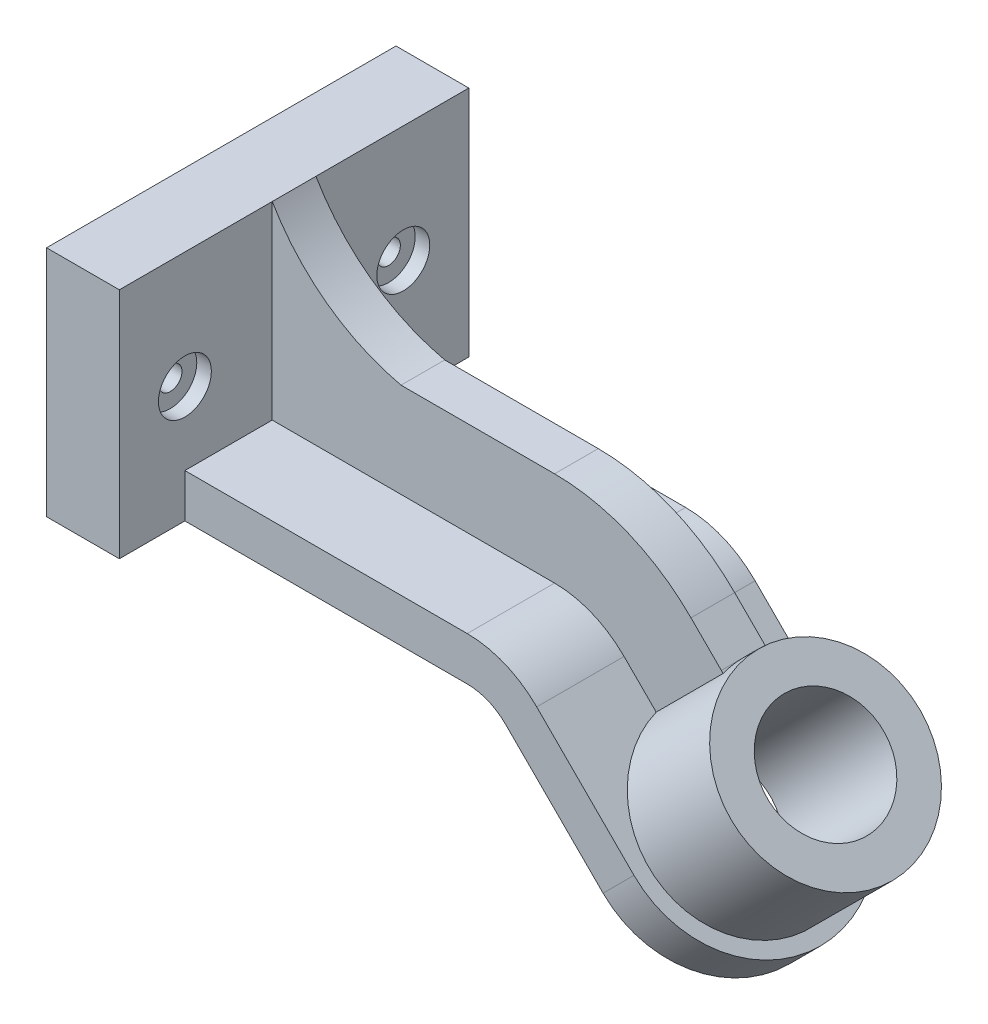
from build123d import *

# Parameters (mm, degrees)
SKETCH1_W                               = 96
SKETCH1_H                               = 64
BOSS_EXTRUDE1_DEPTH                     = 20
CBORE_FOR_M6_HEX_HEAD_BOLT1_D           = 6.4
CBORE_FOR_M6_HEX_HEAD_BOLT1_CBORE_D     = 14.547
CBORE_FOR_M6_HEX_HEAD_BOLT1_CBORE_DEPTH = 4
BOSS_EXTRUDE3_DEPTH                     = 60
CUT_EXTRUDE1_DEPTH                      = 12
SKETCH14_R                              = 26
SKETCH14_R_2                            = 16
BOSS_EXTRUDE4_DEPTH                     = 32
BOSS_EXTRUDE8_START                     = -12
BOSS_EXTRUDE8_DEPTH                     = 12
SKETCH17_R                              = 16
CUT_EXTRUDE2_DEPTH                      = 198.440406876


with BuildPart() as part:
    # Sketch1 → Boss-Extrude1 (new body)
    with BuildSketch(Plane(origin=(0, 0, 0), x_dir=(0, 0, -1), z_dir=(1, 0, 0))):
        Rectangle(SKETCH1_W, SKETCH1_H)
    extrude(amount=BOSS_EXTRUDE1_DEPTH)

    # CBORE for M6 Hex Head Bolt1 (through all)
    with Locations(Plane(origin=(20, 0, -30), x_dir=(0, 0, 1), z_dir=(1, 0, 0))):
        with Locations((0, 0)):
            cbore_for_m6_hex_head_bolt1 = CounterBoreHole(CBORE_FOR_M6_HEX_HEAD_BOLT1_D / 2, CBORE_FOR_M6_HEX_HEAD_BOLT1_CBORE_D / 2, CBORE_FOR_M6_HEX_HEAD_BOLT1_CBORE_DEPTH)

    # Mirror1: CBORE for M6 Hex Head Bolt1 across plane
    add(cbore_for_m6_hex_head_bolt1.mirror(Plane.XY), mode=Mode.SUBTRACT)

    # Sketch11 → Boss-Extrude3 (add)
    with BuildSketch(Plane(origin=(0, 0, -30), x_dir=(0, -1, 0), z_dir=(0, 0, 1))):
        with BuildLine():
            ThreePointArc((20, 97.56139982), (22.055252622, 107.893852494), (27.908116908, 116.653282912))
            Line((27.908116908, 116.653282912), (75.840620434, 164.585786438))
            Line((75.840620434, 164.585786438), (84.325901808, 156.100505063))
            Line((84.325901808, 156.100505063), (36.393398282, 108.168001538))
            ThreePointArc((36.393398282, 108.168001538), (33.141807012, 103.301651305), (32, 97.56139982))
            Line((32, 97.56139982), (32, 20))
            Line((32, 20), (20, 20))
            Line((20, 20), (20, 97.56139982))
        make_face()
    extrude(amount=BOSS_EXTRUDE3_DEPTH)

    # Sketch13 → Cut-Extrude1 (cut)
    with BuildSketch(Plane(origin=(44.372583002, 44.372583002, 0), x_dir=(0, 0, -1), z_dir=(0.7071067811865476, 0.7071067811865476, 0))):
        with BuildLine():
            Line((-30, -140.007142675), (-38.734920635, -140.007142675))
            Line((-38.734920635, -140.007142675), (-38.734920635, -179.207032884))
            Line((-38.734920635, -179.207032884), (30.889896781, -179.207032884))
            Line((30.889896781, -179.207032884), (30.889896781, -140.007142675))
            Line((30.889896781, -140.007142675), (30, -140.007142675))
            ThreePointArc((30, -140.007142675), (0, -170.007142675), (-30, -140.007142675))
        make_face()
    extrude(amount=-CUT_EXTRUDE1_DEPTH, mode=Mode.SUBTRACT)

    # Sketch14 → Boss-Extrude4 (add)
    with BuildSketch(Plane(origin=(44.372583002, 44.372583002, 0), x_dir=(0, 0, -1), z_dir=(0.7071067811865476, 0.7071067811865476, 0))):
        with Locations(Location((0, -140.007142675, 0), (0, 0, 90))):
            Circle(SKETCH14_R)
        with Locations(Location((0, -140.007142675, 0), (0, 0, 90))):
            Circle(SKETCH14_R_2, mode=Mode.SUBTRACT)
    extrude(amount=BOSS_EXTRUDE4_DEPTH)

    # Sketch16 → Boss-Extrude8 (add)
    with BuildSketch(Plane.XY.offset(6).offset(BOSS_EXTRUDE8_START)):
        with BuildLine():
            Line((20, 32), (20, -20))
            Line((20, -20), (97.56139982, -20))
            ThreePointArc((97.56139982, -20), (107.893852494, -22.055252622), (116.653282912, -27.908116908))
            Line((116.653282912, -27.908116908), (124.987806691, -36.242640687))
            Line((124.987806691, -36.242640687), (132.712452622, -43.967286618))
            Line((132.712452622, -43.967286618), (151.159621824, -25.520117415))
            Line((151.159621824, -25.520117415), (143.372583002, -17.857864376))
            Line((143.372583002, -17.857864376), (135.038059223, -9.523340597))
            ThreePointArc((135.038059223, -9.523340597), (117.843621735, 1.965615223), (97.56139982, 6))
            Line((97.56139982, 6), (55.38418899, 6))
            ThreePointArc((55.38418899, 6), (34.984926343, 15.315732711), (20, 32))
        make_face()
    extrude(amount=BOSS_EXTRUDE8_DEPTH)

    # Sketch17 → Cut-Extrude2 (cut, through all)
    with BuildSketch(Plane(origin=(67, 67, 0), x_dir=(0, 0, -1), z_dir=(0.7071067811865477, 0.7071067811865475, 0))):
        with Locations(Location((0, -140.007142675, 0), (0, 0, 90))):
            Circle(SKETCH17_R)
    extrude(amount=-CUT_EXTRUDE2_DEPTH, mode=Mode.SUBTRACT)


solid = part.part
